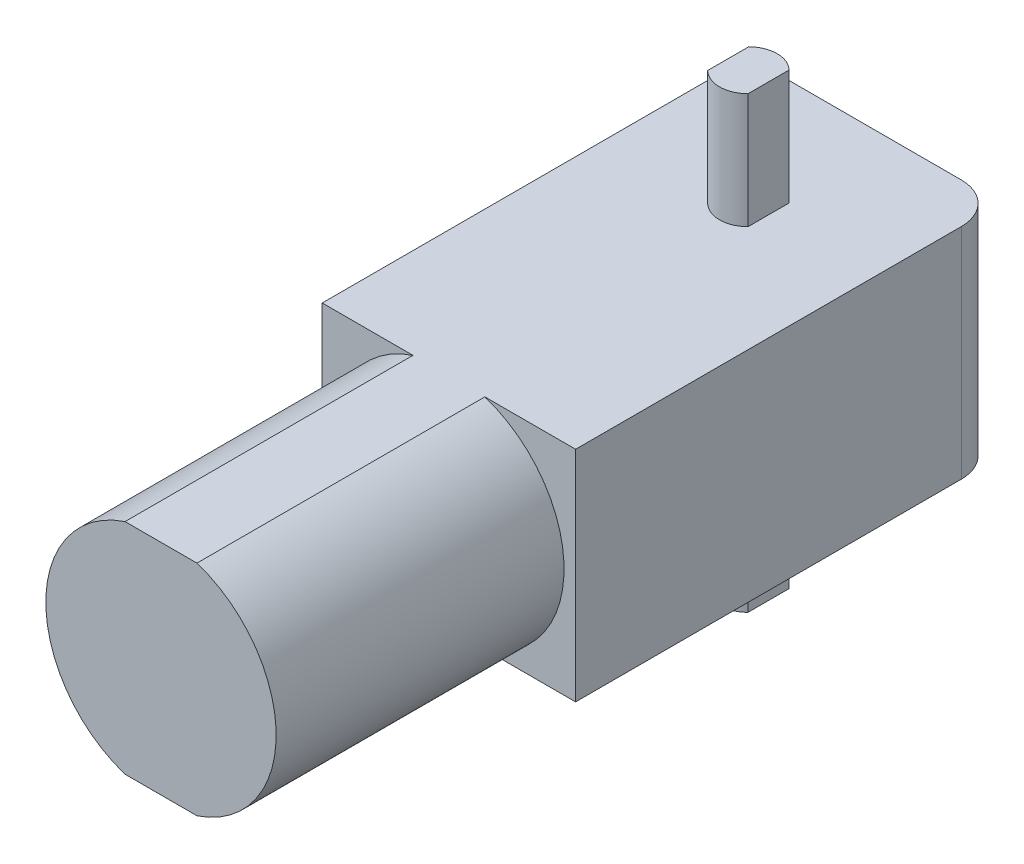
from build123d import *

# Parameters (mm, degrees)
SKETCH1_W           = 19
SKETCH1_H           = 22
BOSS_EXTRUDE1_DEPTH = 37
FILLET1_R           = 3.5
BOSS_EXTRUDE2_DEPTH = 19.5
BOSS_EXTRUDE3_DEPTH = 25


with BuildPart() as part:
    # Sketch1 → Boss-Extrude1 (new body)
    with BuildSketch(Plane(origin=(0, 0, 0), x_dir=(0, 1, 0), z_dir=(0, 0, 1))):
        with Locations((9.5, 11)):
            Rectangle(SKETCH1_W, SKETCH1_H)
    extrude(amount=BOSS_EXTRUDE1_DEPTH)

    # Fillet1
    fillet1_edges = [part.edges().sort_by_distance(p)[0] for p in [
        (-22, 9.5, 0),
        (0, 9.5, 0),
    ]]
    fillet(fillet1_edges, radius=FILLET1_R)

    # Sketch2 → Boss-Extrude2 (add, symmetric)
    with BuildSketch(Plane(origin=(0, 9.5, 0), x_dir=(1, 0, 0), z_dir=(0, 1, 0))):
        with BuildLine():
            Line((-12.75, -9.214642893), (-12.75, -11))
            Line((-12.75, -11), (-12.75, -12.785357107))
            ThreePointArc((-12.75, -12.785357107), (-11, -13.5), (-9.25, -12.785357107))
            Line((-9.25, -12.785357107), (-9.25, -11))
            Line((-9.25, -11), (-9.25, -9.214642893))
            ThreePointArc((-9.25, -9.214642893), (-11, -8.5), (-12.75, -9.214642893))
        make_face()
    extrude(amount=BOSS_EXTRUDE2_DEPTH, both=True)

    # Sketch4 → Boss-Extrude3 (add)
    with BuildSketch(Plane.XY.offset(37)):
        with BuildLine():
            Line((-7.877501001, 19), (-11, 19))
            Line((-11, 19), (-11, 0))
            Line((-11, 0), (-7.877501001, 0))
            ThreePointArc((-7.877501001, 0), (-2.899845989, 3.635913967), (-1, 9.5))
            ThreePointArc((-1, 9.5), (-2.899845989, 15.364086033), (-7.877501001, 19))
        make_face()
        with BuildLine():
            Line((-11, 0), (-11, 19))
            Line((-11, 19), (-14.122498999, 19))
            ThreePointArc((-14.122498999, 19), (-21, 9.5), (-14.122498999, 0))
            Line((-14.122498999, 0), (-11, 0))
        make_face()
    extrude(amount=BOSS_EXTRUDE3_DEPTH)


solid = part.part
